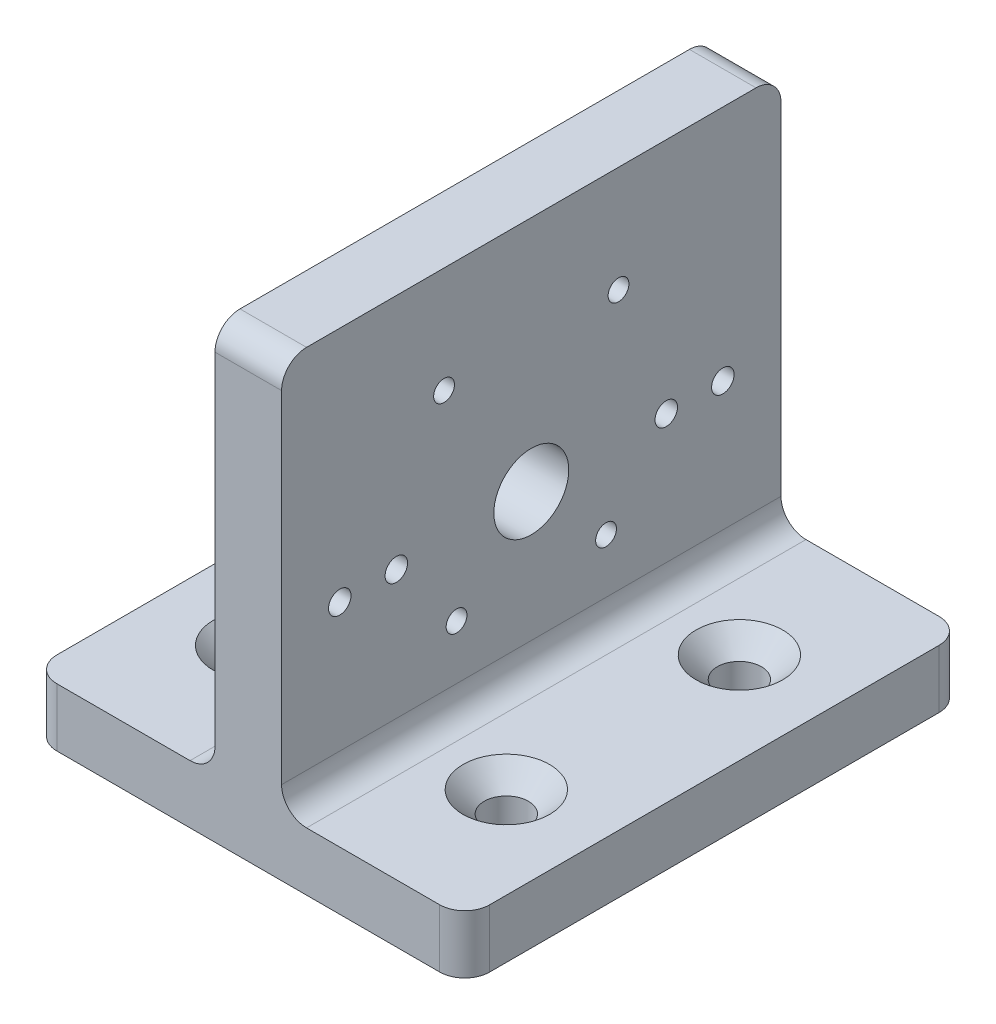
from build123d import *

# Parameters (mm, degrees)
BOSS_EXTRUDE1_DEPTH                                  = 60
FILLET1_R                                            = 3
SKETCH2_R                                            = 4.5
CUT_EXTRUDE1_DEPTH                                   = 8
TAP_DRILL_FOR_M3_TAP1_D                              = 2.7
TAP_DRILL_FOR_M3_TAP2_D                              = 2.5
CSK_FOR_M5_COUNTERSUNK_RAISED_HEAD_SCREW_D           = 5.3
CSK_FOR_M5_COUNTERSUNK_RAISED_HEAD_SCREW_CSINK_D     = 10.4
CSK_FOR_M5_COUNTERSUNK_RAISED_HEAD_SCREW_CSINK_ANGLE = 90


with BuildPart() as part:
    # Sketch1 → Boss-Extrude1 (new body)
    with BuildSketch(Plane.XY):
        Polygon((-4, 7), (-26, 7), (-26, 0), (26, 0), (26, 7), (4, 7), (4, 54), (-4, 54), align=None)
    extrude(amount=BOSS_EXTRUDE1_DEPTH)

    # Fillet1
    fillet1_edges = [part.edges().sort_by_distance(p)[0] for p in [
        (0, 54, 0),
        (26, 3.5, 0),
        (-26, 3.5, 0),
        (26, 3.5, 60),
        (-4, 7, 30),
        (4, 7, 30),
        (0, 54, 60),
        (-26, 3.5, 60),
    ]]
    fillet(fillet1_edges, radius=FILLET1_R)

    # Sketch2 → Cut-Extrude1 (cut)
    with BuildSketch(Plane(origin=(4, 0, 0), x_dir=(0, 0, -1), z_dir=(1, 0, 0))):
        with Locations(Location((-30, 25.5, 0), (0, 0, 90))):
            Circle(SKETCH2_R)
    extrude(amount=-CUT_EXTRUDE1_DEPTH, mode=Mode.SUBTRACT)

    # Tap Drill for M3 Tap1 (through all)
    with Locations(Plane(origin=(4, 25.5, 46.215), x_dir=(0, 1, 0), z_dir=(1, 0, 0))):
        with Locations((0, 0), (0, -32.43), (0, 6.7975), (0, -39.2275)):
            Hole(TAP_DRILL_FOR_M3_TAP1_D / 2)

    # Tap Drill for M3 Tap2 (through all)
    with Locations(Plane(origin=(4, 41.25, 40.48), x_dir=(0, 0, 1), z_dir=(1, 0, 0))):
        with Locations((0, 0), (-20.96, 0), (-19.460256121, 24.730256121), (-1.499743879, 24.730256121)):
            Hole(TAP_DRILL_FOR_M3_TAP2_D / 2)

    # CSK for M5 Countersunk Raised Head Screw1 (through all)
    with Locations(Plane(origin=(-15, 7, 16), x_dir=(1, 0, 0), z_dir=(0, 1, 0))):
        with Locations((0, 0), (0, -28), (30, -28), (30, 0)):
            CounterSinkHole(CSK_FOR_M5_COUNTERSUNK_RAISED_HEAD_SCREW_D / 2, CSK_FOR_M5_COUNTERSUNK_RAISED_HEAD_SCREW_CSINK_D / 2, counter_sink_angle=CSK_FOR_M5_COUNTERSUNK_RAISED_HEAD_SCREW_CSINK_ANGLE)


solid = part.part
